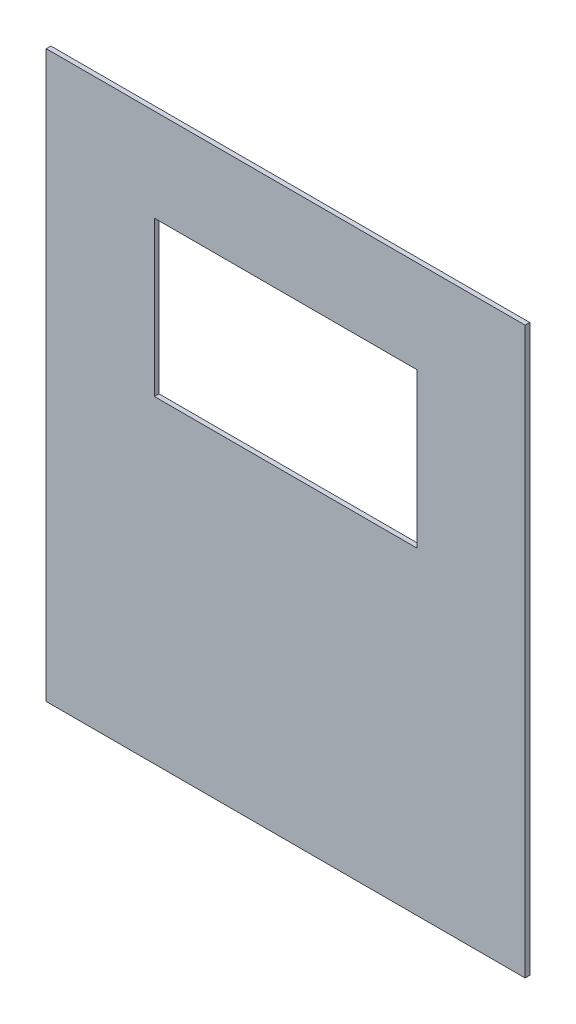
from build123d import *

# Parameters (mm, degrees)
SKETCH_1_W      = 310
SKETCH_1_H      = 366
SKETCH_1_W_2    = 170
SKETCH_1_H_2    = 100
EXTRUDE_1_DEPTH = 3


with BuildPart() as part:
    # 草图1 → 凸台-拉伸1 (new body)
    with BuildSketch(Plane.XY):
        with Locations((155, 183)):
            Rectangle(SKETCH_1_W, SKETCH_1_H)
        with Locations((155, 256)):
            Rectangle(SKETCH_1_W_2, SKETCH_1_H_2, mode=Mode.SUBTRACT)
    extrude(amount=EXTRUDE_1_DEPTH)


solid = part.part
